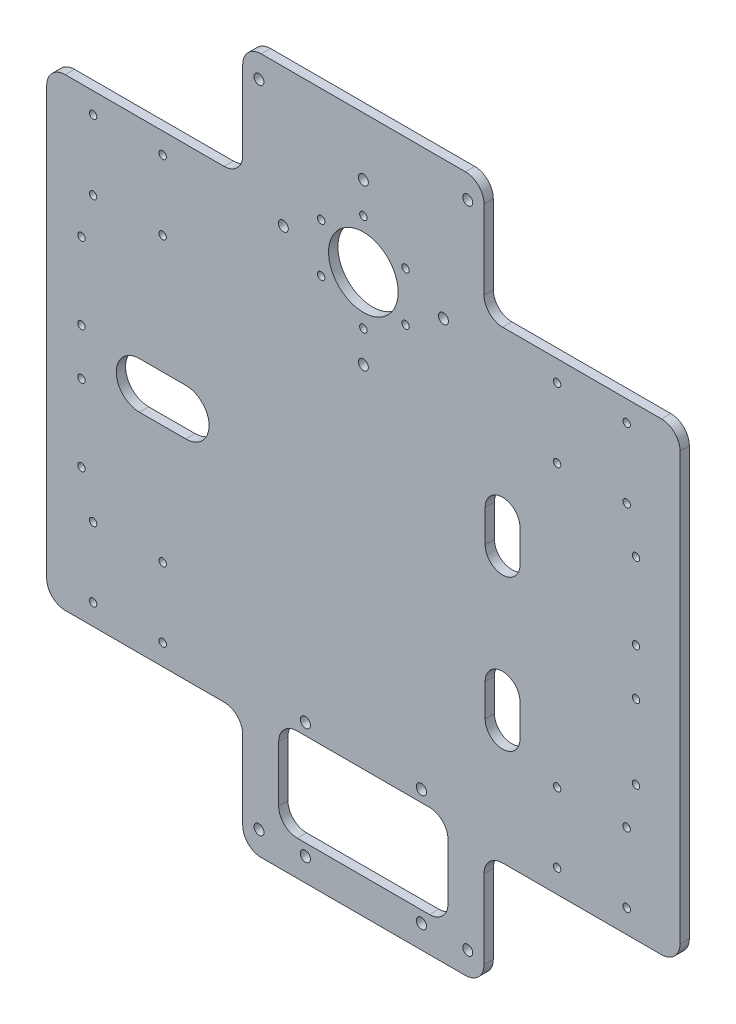
from build123d import *

# Parameters (mm, degrees)
SKETCH_281X300_25_R   = 1.6
SKETCH_281X300_25_R_2 = 15
SKETCH_281X300_25_R_3 = 2.15
SKETCH_281X300_25_R_4 = 2.2
SKETCH_281X300_25_W   = 73
SKETCH_281X300_25_H   = 40
F_4MM_DEPTH           = 4
FILLET_1_R            = 8


with BuildPart() as part:
    # 底板轮廓_281x300_安装孔外移25 → 凸台拉伸_4mm (new body)
    with BuildSketch(Plane.XY):
        Polygon((-51, 150), (53, 150), (53, 100), (137.5, 100), (137.5, -100), (53, -100), (53, -150), (-51, -150), (-51, -100), (-135.5, -100), (-135.5, 100), (-51, 100), align=None)
        with Locations((84.5, -60)):
            Circle(SKETCH_281X300_25_R, mode=Mode.SUBTRACT)
        with Locations((114.5, -60)):
            Circle(SKETCH_281X300_25_R, mode=Mode.SUBTRACT)
        with Locations((84.5, 61)):
            Circle(SKETCH_281X300_25_R, mode=Mode.SUBTRACT)
        with Locations((1, 90.5)):
            Circle(SKETCH_281X300_25_R_2, mode=Mode.SUBTRACT)
        with Locations((1, 125)):
            Circle(SKETCH_281X300_25_R_3, mode=Mode.SUBTRACT)
        with Locations((-33.5, 90.5)):
            Circle(SKETCH_281X300_25_R_3, mode=Mode.SUBTRACT)
        with Locations((35.5, 90.5)):
            Circle(SKETCH_281X300_25_R_3, mode=Mode.SUBTRACT)
        with Locations((-44, 140)):
            Circle(SKETCH_281X300_25_R_3, mode=Mode.SUBTRACT)
        with Locations((114.5, 61)):
            Circle(SKETCH_281X300_25_R, mode=Mode.SUBTRACT)
        with Locations((1, 56)):
            Circle(SKETCH_281X300_25_R_3, mode=Mode.SUBTRACT)
        with Locations((26, -140)):
            Circle(SKETCH_281X300_25_R_4, mode=Mode.SUBTRACT)
        with Locations((-24, -140)):
            Circle(SKETCH_281X300_25_R_4, mode=Mode.SUBTRACT)
        with Locations((-24, -90)):
            Circle(SKETCH_281X300_25_R_4, mode=Mode.SUBTRACT)
        with Locations((26, -90)):
            Circle(SKETCH_281X300_25_R_4, mode=Mode.SUBTRACT)
        with Locations((1, 111.5)):
            Circle(SKETCH_281X300_25_R, mode=Mode.SUBTRACT)
        with Locations((84.5, -90)):
            Circle(SKETCH_281X300_25_R, mode=Mode.SUBTRACT)
        with Locations((84.5, 91)):
            Circle(SKETCH_281X300_25_R, mode=Mode.SUBTRACT)
        with Locations((114.5, 91)):
            Circle(SKETCH_281X300_25_R, mode=Mode.SUBTRACT)
        with Locations((114.5, -90)):
            Circle(SKETCH_281X300_25_R, mode=Mode.SUBTRACT)
        with Locations((118.5, 10)):
            Circle(SKETCH_281X300_25_R, mode=Mode.SUBTRACT)
        with Locations((118.5, -10)):
            Circle(SKETCH_281X300_25_R, mode=Mode.SUBTRACT)
        with Locations((-120.5, 10)):
            Circle(SKETCH_281X300_25_R, mode=Mode.SUBTRACT)
        with Locations((-120.5, -10)):
            Circle(SKETCH_281X300_25_R, mode=Mode.SUBTRACT)
        with Locations((-115.5, -91)):
            Circle(SKETCH_281X300_25_R, mode=Mode.SUBTRACT)
        with Locations((-85.5, -91)):
            Circle(SKETCH_281X300_25_R, mode=Mode.SUBTRACT)
        with Locations((-115.5, 91)):
            Circle(SKETCH_281X300_25_R, mode=Mode.SUBTRACT)
        with Locations((-85.5, 91)):
            Circle(SKETCH_281X300_25_R, mode=Mode.SUBTRACT)
        with Locations((-85.5, 61)):
            Circle(SKETCH_281X300_25_R, mode=Mode.SUBTRACT)
        with Locations((-115.5, 61)):
            Circle(SKETCH_281X300_25_R, mode=Mode.SUBTRACT)
        with Locations((-85.5, -61)):
            Circle(SKETCH_281X300_25_R, mode=Mode.SUBTRACT)
        with Locations((-115.5, -61)):
            Circle(SKETCH_281X300_25_R, mode=Mode.SUBTRACT)
        with Locations((118.5, 43)):
            Circle(SKETCH_281X300_25_R, mode=Mode.SUBTRACT)
        with Locations((118.5, -42)):
            Circle(SKETCH_281X300_25_R, mode=Mode.SUBTRACT)
        with Locations((-120.5, 43)):
            Circle(SKETCH_281X300_25_R, mode=Mode.SUBTRACT)
        with Locations((46, 140)):
            Circle(SKETCH_281X300_25_R_3, mode=Mode.SUBTRACT)
        with Locations((-44, -140)):
            Circle(SKETCH_281X300_25_R_3, mode=Mode.SUBTRACT)
        with Locations((46, -140)):
            Circle(SKETCH_281X300_25_R_3, mode=Mode.SUBTRACT)
        with Locations((19.186533479, 101)):
            Circle(SKETCH_281X300_25_R, mode=Mode.SUBTRACT)
        with Locations((19.186533479, 80)):
            Circle(SKETCH_281X300_25_R, mode=Mode.SUBTRACT)
        with Locations((1, 69.5)):
            Circle(SKETCH_281X300_25_R, mode=Mode.SUBTRACT)
        with Locations((-17.186533479, 80)):
            Circle(SKETCH_281X300_25_R, mode=Mode.SUBTRACT)
        with Locations((-17.186533479, 101)):
            Circle(SKETCH_281X300_25_R, mode=Mode.SUBTRACT)
        with Locations((-120.5, -43)):
            Circle(SKETCH_281X300_25_R, mode=Mode.SUBTRACT)
        with BuildLine():
            Line((68.5, -50), (68.5, -36))
            ThreePointArc((68.5, -36), (61, -28.5), (53.5, -36))
            Line((53.5, -36), (53.5, -50))
            ThreePointArc((53.5, -50), (61, -57.5), (68.5, -50))
        make_face(mode=Mode.SUBTRACT)
        with BuildLine():
            Line((-95.5, -10), (-75.5, -10))
            ThreePointArc((-75.5, -10), (-65.5, 0), (-75.5, 10))
            Line((-75.5, 10), (-95.5, 10))
            ThreePointArc((-95.5, 10), (-105.5, 0), (-95.5, -10))
        make_face(mode=Mode.SUBTRACT)
        with Locations((1, -115)):
            Rectangle(SKETCH_281X300_25_W, SKETCH_281X300_25_H, mode=Mode.SUBTRACT)
        with BuildLine():
            Line((53.5, 29), (53.5, 15))
            ThreePointArc((53.5, 15), (61, 7.5), (68.5, 15))
            Line((68.5, 15), (68.5, 29))
            ThreePointArc((68.5, 29), (61, 36.5), (53.5, 29))
        make_face(mode=Mode.SUBTRACT)
    extrude(amount=F_4MM_DEPTH)

    # 圆角1
    fillet_1_edges = [part.edges().sort_by_distance(p)[0] for p in [
        (53, -150, 2),
        (-51, -150, 2),
        (-51, -100, 2),
        (-135.5, -100, 2),
        (-135.5, 100, 2),
        (-51, 100, 2),
        (-51, 150, 2),
        (53, 150, 2),
        (53, 100, 2),
        (137.5, 100, 2),
        (137.5, -100, 2),
        (53, -100, 2),
        (-35.5, -95, 2),
        (-35.5, -135, 2),
        (37.5, -135, 2),
        (37.5, -95, 2),
    ]]
    fillet(fillet_1_edges, radius=FILLET_1_R)


solid = part.part
